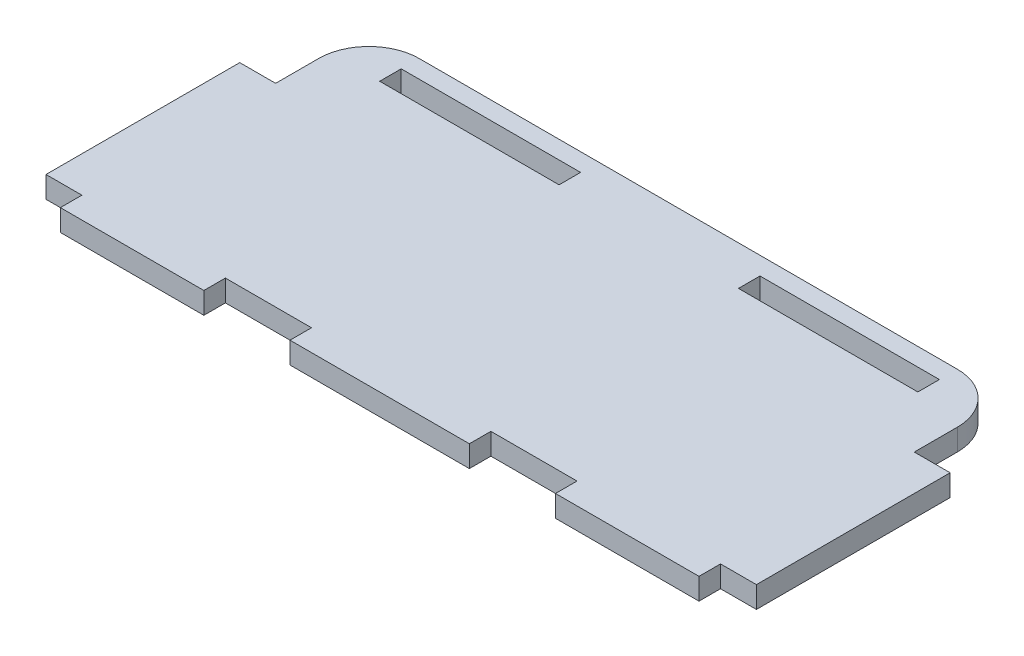
from build123d import *

# Parameters (mm, degrees)
ESTRUSIONE_ESTRUSIONE1_DEPTH      = 30
ESTRUSIONE_ESTRUSIONE1_DEPTH_BACK = 3
SCHIZZO1_W                        = 89
SCHIZZO1_H                        = 3
SCHIZZO2_W                        = 12
SCHIZZO2_H                        = 3
TAGLIO_ESTRUSIONE1_DEPTH          = 10
SCHIZZO3_W                        = 27
SCHIZZO3_H                        = 3
ESTRUSIONE_ESTRUSIONE2_DEPTH      = 5
SCHIZZO4_W                        = 89
SCHIZZO4_H                        = 3
ESTRUSIONE_ESTRUSIONE3_DEPTH      = 10
SCHIZZO5_W                        = 25
SCHIZZO5_H                        = 3
TAGLIO_ESTRUSIONE2_DEPTH          = 8
RACCORDO1_R                       = 7


with BuildPart() as part:
    # Schizzo1 → Estrusione-Estrusione1 (new, two sides: drawn at the far end of the back side and taken through both)
    with BuildSketch(Plane.XY.offset(-ESTRUSIONE_ESTRUSIONE1_DEPTH_BACK)):
        with Locations((0, -22.5)):
            Rectangle(SCHIZZO1_W, SCHIZZO1_H)
    extrude(amount=ESTRUSIONE_ESTRUSIONE1_DEPTH + ESTRUSIONE_ESTRUSIONE1_DEPTH_BACK)

    # Schizzo2 → Taglio-Estrusione1 (cut)
    with BuildSketch(Plane(origin=(0, -21, 0), x_dir=(1, 0, 0), z_dir=(0, 1, 0))):
        with Locations((18.5, -28.5)):
            Rectangle(SCHIZZO2_W, SCHIZZO2_H)
        with Locations((-18.5, -28.5)):
            Rectangle(SCHIZZO2_W, SCHIZZO2_H)
    extrude(amount=-TAGLIO_ESTRUSIONE1_DEPTH, mode=Mode.SUBTRACT)

    # Schizzo3 → Estrusione-Estrusione2 (add)
    with BuildSketch(Plane(origin=(44.5, 0, 0), x_dir=(0, 0, -1), z_dir=(1, 0, 0))):
        with Locations((-13.5, -22.5)):
            Rectangle(SCHIZZO3_W, SCHIZZO3_H)
    estrusione_estrusione2 = extrude(amount=ESTRUSIONE_ESTRUSIONE2_DEPTH)

    # Specchia1: Estrusione-Estrusione2 across plane
    add(estrusione_estrusione2.mirror(Plane(origin=(0, 0, 0), x_dir=(0, 0, 1), z_dir=(1, 0, 0))))

    # Schizzo4 → Estrusione-Estrusione3 (add)
    with BuildSketch(Plane(origin=(0, 0, -3), x_dir=(-1, 0, 0), z_dir=(0, 0, -1))):
        with Locations((0, -22.5)):
            Rectangle(SCHIZZO4_W, SCHIZZO4_H)
    extrude(amount=ESTRUSIONE_ESTRUSIONE3_DEPTH)

    # Schizzo5 → Taglio-Estrusione2 (cut)
    with BuildSketch(Plane(origin=(0, -21, 0), x_dir=(1, 0, 0), z_dir=(0, 1, 0))):
        with Locations((-25, 9)):
            Rectangle(SCHIZZO5_W, SCHIZZO5_H)
        with Locations((25, 9)):
            Rectangle(SCHIZZO5_W, SCHIZZO5_H)
    extrude(amount=-TAGLIO_ESTRUSIONE2_DEPTH, mode=Mode.SUBTRACT)

    # Raccordo1
    raccordo1_edges = [part.edges().sort_by_distance(p)[0] for p in [
        (-44.5, -22.5, -13),
        (44.5, -22.5, -13),
    ]]
    fillet(raccordo1_edges, radius=RACCORDO1_R)


solid = part.part
